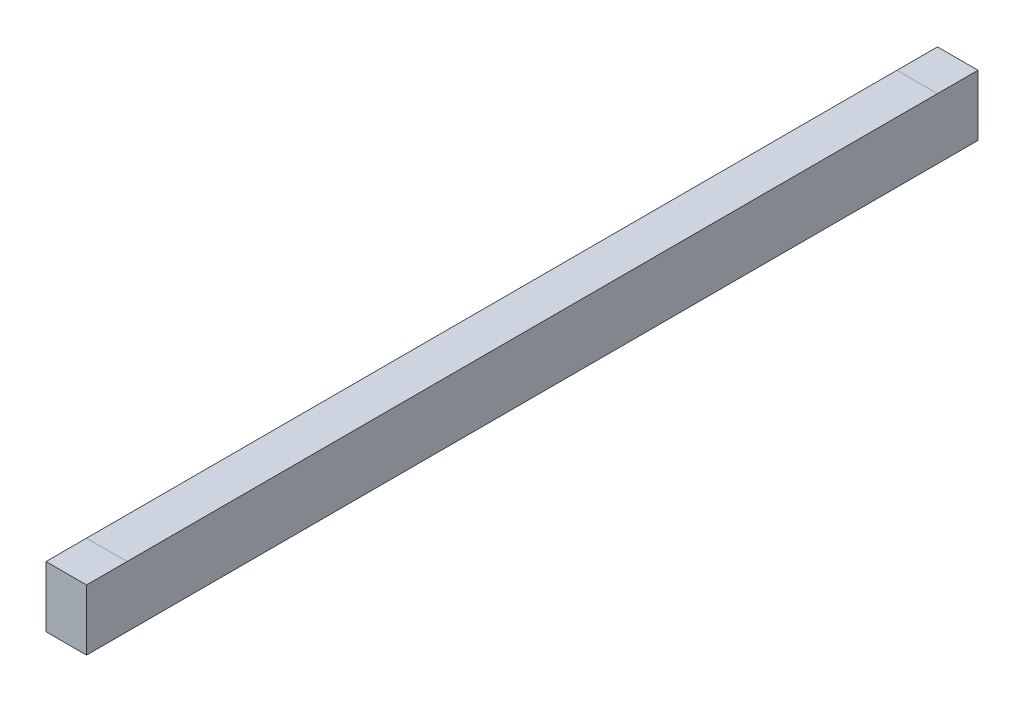
from build123d import *

# Parameters (mm, degrees)
SZKIC1_W                    = 100
SZKIC1_H                    = 150
DODANIE_WYCI_GNI_CIE1_DEPTH = 2200


with BuildPart() as part:
    # Szkic1 → Dodanie-wyciągnięcie1 (new body)
    with BuildSketch(Plane.XY):
        with Locations((50, 75)):
            Rectangle(SZKIC1_W, SZKIC1_H)
    extrude(amount=DODANIE_WYCI_GNI_CIE1_DEPTH)


solid = part.part
